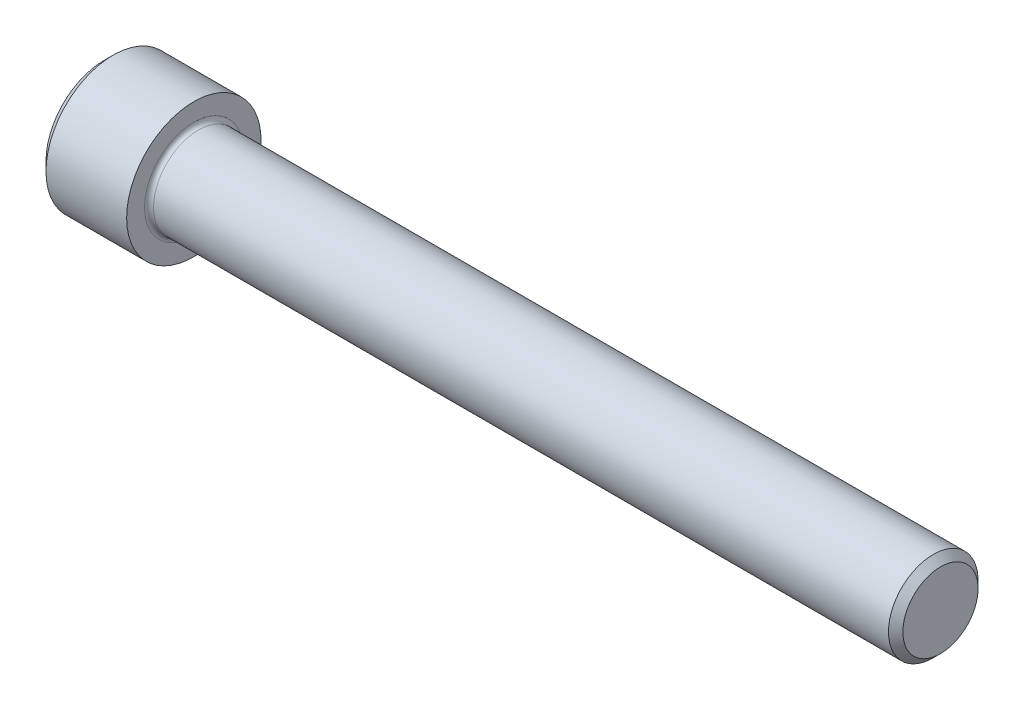
from build123d import *

# Parameters (mm, degrees)
FILLET1_R   = 0.6
HEX_2_DEPTH = 6


with BuildPart() as part:
    # BodySke → Base-Revolve (revolve)
    with BuildSketch(Plane.XY, mode=Mode.PRIVATE) as base_revolve_sk:
        Polygon((0, 0), (0, 7.8), (1.2, 9), (12, 9), (12, 6), (111.036, 6), (112, 5.036), (112, 0), align=None)
    revolve(base_revolve_sk.sketch.rotate(Axis((-31.75, 0, 0), (1, 0, 0)), 90), axis=Axis((-31.75, 0, 0), (1, 0, 0)))

    # Fillet1
    fillet1_edges = [part.edges().sort_by_distance(p)[0] for p in [
        (12, 0, -6),
    ]]
    fillet(fillet1_edges, radius=FILLET1_R)

    # Sketch2 → Hex-PreBroach (revolve, cut)
    with BuildSketch(Plane.XY, mode=Mode.PRIVATE) as hex_prebroach_sk:
        Polygon((0, 5.0575), (6, 5.0575), (8.919948986, 0), (0, 0), align=None)
    revolve(hex_prebroach_sk.sketch.rotate(Axis((0, 0, 0), (1, 0, 0)), 90), axis=Axis((0, 0, 0), (1, 0, 0)), mode=Mode.SUBTRACT)

    # Sketch3 → Hex 2 (cut)
    with BuildSketch(Plane(origin=(0, 0, 0), x_dir=(0, 0.500000000000001, 0.866025403784438), z_dir=(-1, 0, 0))):
        Polygon((2.919948986, 5.0575), (-2.919948986, 5.0575), (-5.839897973, 0), (-2.919948986, -5.0575), (2.919948986, -5.0575), (5.839897973, 0), align=None)
    extrude(amount=-HEX_2_DEPTH, mode=Mode.SUBTRACT)


solid = part.part
